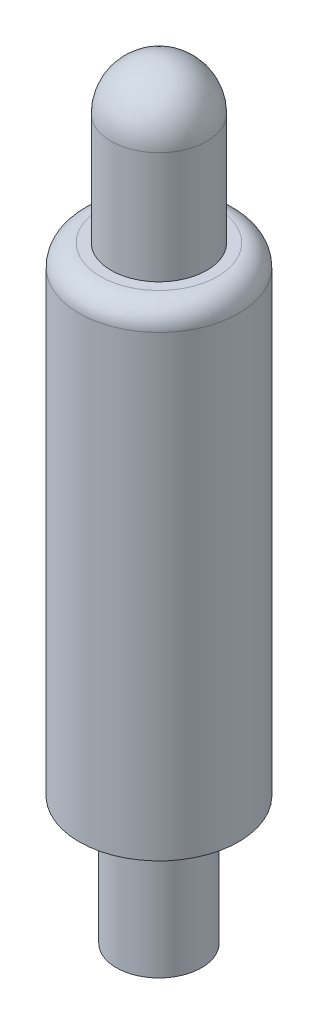
from build123d import *

# Parameters (mm, degrees)
SKETCH_1_R      = 0.75
EXTRUDE_1_DEPTH = 4.5
SKETCH_2_R      = 0.45
EXTRUDE_2_DEPTH = 1.5
SKETCH_3_R      = 0.4
EXTRUDE_3_DEPTH = 1.2
FILLET_1_R      = 0.2
FILLET_2_R      = 0.45


with BuildPart() as part:
    # 草图1 → 凸台-拉伸1 (new body)
    with BuildSketch(Plane(origin=(0, 0, 0), x_dir=(1, 0, 0), z_dir=(0, 1, 0))):
        with Locations(Location((0, 0, 0), (0, 0, 270))):
            Circle(SKETCH_1_R)
    extrude(amount=EXTRUDE_1_DEPTH)

    # 草图2 → 凸台-拉伸2 (add)
    with BuildSketch(Plane(origin=(0, 4.5, 0), x_dir=(1, 0, 0), z_dir=(0, 1, 0))):
        with Locations(Location((0, 0, 0), (0, 0, 270))):
            Circle(SKETCH_2_R)
    extrude(amount=EXTRUDE_2_DEPTH)

    # 草图3 → 凸台-拉伸3 (add)
    with BuildSketch(Plane.XZ):
        with Locations(Location((0, 0, 0), (0, 0, 270))):
            Circle(SKETCH_3_R)
    extrude(amount=EXTRUDE_3_DEPTH)

    # 圆角1
    fillet_1_edges = [part.edges().sort_by_distance(p)[0] for p in [
        (0, 4.5, -0.75),
    ]]
    fillet(fillet_1_edges, radius=FILLET_1_R)

    # 圆角2
    fillet_2_edges = [part.edges().sort_by_distance(p)[0] for p in [
        (0, 6, -0.45),
    ]]
    fillet(fillet_2_edges, radius=FILLET_2_R)


solid = part.part
